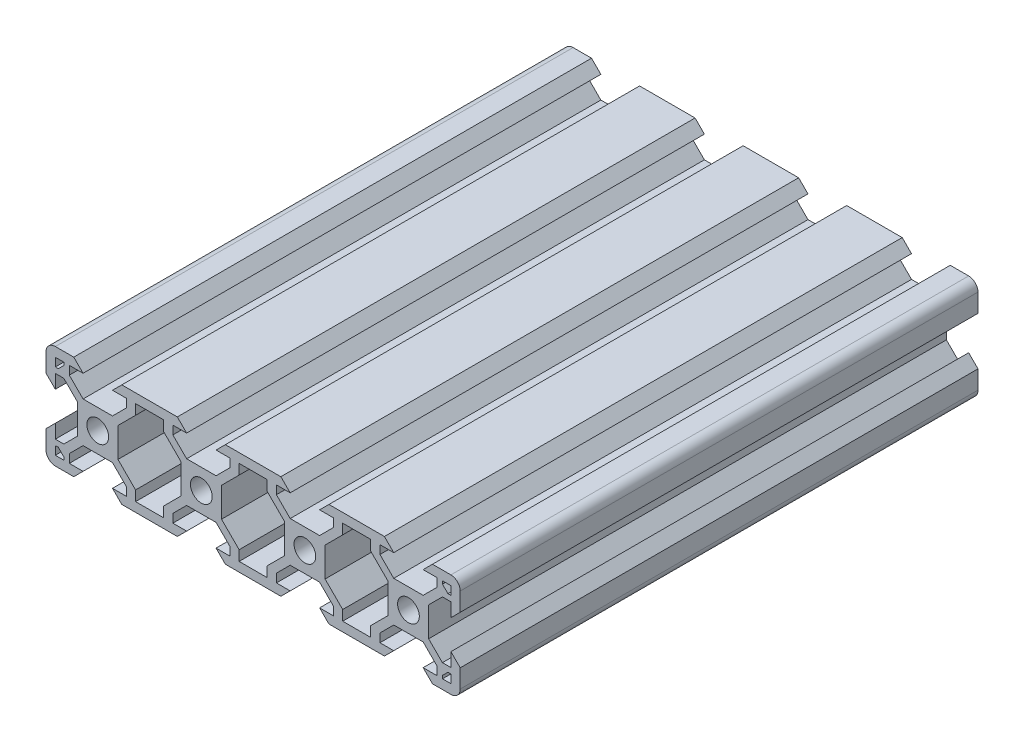
from build123d import *

# Parameters (mm, degrees)
ESQUISSE1_R        = 2.1
BOSS_EXTRU_1_DEPTH = 50


with BuildPart() as part:
    # Esquisse1 → Boss.-Extru.1 (new, symmetric)
    with BuildSketch(Plane.XY):
        with BuildLine():
            Line((-38.199999929, 10), (-34.639999675, 10))
            Line((-34.639999675, 10), (-32.839999603, 8.2))
            Line((-32.839999603, 8.2), (-35.499339671, 8.2))
            Line((-35.499339671, 8.2), (-35.499339671, 6.56))
            Line((-35.499339671, 6.56), (-32.839999603, 3.900660038))
            Line((-32.839999603, 3.900660038), (-27.159999603, 3.900660038))
            Line((-27.159999603, 3.900660038), (-24.500659536, 6.56))
            Line((-24.500659536, 6.56), (-24.500659536, 8.2))
            Line((-24.500659536, 8.2), (-27.159999603, 8.2))
            Line((-27.159999603, 8.2), (-25.359999532, 10))
            Line((-25.359999532, 10), (-14.640000468, 10))
            Line((-14.640000468, 10), (-12.840000397, 8.2))
            Line((-12.840000397, 8.2), (-15.499340464, 8.2))
            Line((-15.499340464, 8.2), (-15.499340464, 6.56))
            Line((-15.499340464, 6.56), (-12.840000397, 3.900660038))
            Line((-12.840000397, 3.900660038), (-7.159998809, 3.900660038))
            Line((-7.159998809, 3.900660038), (-4.500658742, 6.56))
            Line((-4.500658742, 6.56), (-4.500658742, 8.2))
            Line((-4.500658742, 8.2), (-7.159998809, 8.2))
            Line((-7.159998809, 8.2), (-5.359998738, 10))
            Line((-5.359998738, 10), (5.359998738, 10))
            Line((5.359998738, 10), (7.159998809, 8.2))
            Line((7.159998809, 8.2), (4.500658742, 8.2))
            Line((4.500658742, 8.2), (4.500658742, 6.56))
            Line((4.500658742, 6.56), (7.159998809, 3.900660038))
            Line((7.159998809, 3.900660038), (12.840000397, 3.900660038))
            Line((12.840000397, 3.900660038), (15.499340464, 6.56))
            Line((15.499340464, 6.56), (15.499340464, 8.2))
            Line((15.499340464, 8.2), (12.840000397, 8.2))
            Line((12.840000397, 8.2), (14.640000468, 10))
            Line((14.640000468, 10), (25.359999532, 10))
            Line((25.359999532, 10), (27.159999603, 8.2))
            Line((27.159999603, 8.2), (24.500659536, 8.2))
            Line((24.500659536, 8.2), (24.500659536, 6.56))
            Line((24.500659536, 6.56), (27.159999603, 3.900660038))
            Line((27.159999603, 3.900660038), (32.839999603, 3.900660038))
            Line((32.839999603, 3.900660038), (35.499339671, 6.56))
            Line((35.499339671, 6.56), (35.499339671, 8.2))
            Line((35.499339671, 8.2), (32.839999603, 8.2))
            Line((32.839999603, 8.2), (34.639999675, 10))
            Line((34.639999675, 10), (38.199999929, 10))
            ThreePointArc((38.199999929, 10), (39.47279216, 9.472792181), (39.999999929, 8.199999929))
            Line((39.999999929, 8.199999929), (39.999999787, 4.639999675))
            Line((39.999999787, 4.639999675), (38.199999716, 2.839999675))
            Line((38.199999716, 2.839999675), (38.199999821, 5.499339742))
            Line((38.199999821, 5.499339742), (36.559999821, 5.499339807))
            Line((36.559999821, 5.499339807), (33.900659754, 2.839999845))
            Line((33.900659754, 2.839999845), (33.900659641, 0))
            Line((33.900659641, 0), (33.900659754, -2.839999845))
            Line((33.900659754, -2.839999845), (36.559999821, -5.499339807))
            Line((36.559999821, -5.499339807), (38.199999821, -5.499339742))
            Line((38.199999821, -5.499339742), (38.199999716, -2.839999675))
            Line((38.199999716, -2.839999675), (39.999999787, -4.639999675))
            Line((39.999999787, -4.639999675), (39.999999929, -8.199999929))
            ThreePointArc((39.999999929, -8.199999929), (39.47279216, -9.472792181), (38.199999929, -10))
            Line((38.199999929, -10), (34.639999675, -10))
            Line((34.639999675, -10), (32.839999603, -8.2))
            Line((32.839999603, -8.2), (35.499339671, -8.2))
            Line((35.499339671, -8.2), (35.499339671, -6.56))
            Line((35.499339671, -6.56), (32.839999603, -3.900660038))
            Line((32.839999603, -3.900660038), (27.159999603, -3.900660038))
            Line((27.159999603, -3.900660038), (24.500659536, -6.56))
            Line((24.500659536, -6.56), (24.500659536, -8.2))
            Line((24.500659536, -8.2), (27.159999603, -8.2))
            Line((27.159999603, -8.2), (25.359999532, -10))
            Line((25.359999532, -10), (14.640000468, -10))
            Line((14.640000468, -10), (12.840000397, -8.2))
            Line((12.840000397, -8.2), (15.499340464, -8.2))
            Line((15.499340464, -8.2), (15.499340464, -6.56))
            Line((15.499340464, -6.56), (12.840000397, -3.900660038))
            Line((12.840000397, -3.900660038), (7.159998809, -3.900660038))
            Line((7.159998809, -3.900660038), (4.500658742, -6.56))
            Line((4.500658742, -6.56), (4.500658742, -8.2))
            Line((4.500658742, -8.2), (7.159998809, -8.2))
            Line((7.159998809, -8.2), (5.359998738, -10))
            Line((5.359998738, -10), (-5.359998738, -10))
            Line((-5.359998738, -10), (-7.159998809, -8.2))
            Line((-7.159998809, -8.2), (-4.500658742, -8.2))
            Line((-4.500658742, -8.2), (-4.500658742, -6.56))
            Line((-4.500658742, -6.56), (-7.159998809, -3.900660038))
            Line((-7.159998809, -3.900660038), (-12.840000397, -3.900660038))
            Line((-12.840000397, -3.900660038), (-15.499340464, -6.56))
            Line((-15.499340464, -6.56), (-15.499340464, -8.2))
            Line((-15.499340464, -8.2), (-12.840000397, -8.2))
            Line((-12.840000397, -8.2), (-14.640000468, -10))
            Line((-14.640000468, -10), (-25.359999532, -10))
            Line((-25.359999532, -10), (-27.159999603, -8.2))
            Line((-27.159999603, -8.2), (-24.500659536, -8.2))
            Line((-24.500659536, -8.2), (-24.500659536, -6.56))
            Line((-24.500659536, -6.56), (-27.159999603, -3.900660038))
            Line((-27.159999603, -3.900660038), (-32.839999603, -3.900660038))
            Line((-32.839999603, -3.900660038), (-35.499339671, -6.56))
            Line((-35.499339671, -6.56), (-35.499339671, -8.2))
            Line((-35.499339671, -8.2), (-32.839999603, -8.2))
            Line((-32.839999603, -8.2), (-34.639999675, -10))
            Line((-34.639999675, -10), (-38.199999929, -10))
            ThreePointArc((-38.199999929, -10), (-39.47279216, -9.472792181), (-39.999999929, -8.199999929))
            Line((-39.999999929, -8.199999929), (-39.999999787, -4.639999675))
            Line((-39.999999787, -4.639999675), (-38.199999716, -2.839999675))
            Line((-38.199999716, -2.839999675), (-38.199999821, -5.499339742))
            Line((-38.199999821, -5.499339742), (-36.559999821, -5.499339807))
            Line((-36.559999821, -5.499339807), (-33.900659754, -2.839999845))
            Line((-33.900659754, -2.839999845), (-33.900659641, 0))
            Line((-33.900659641, 0), (-33.900659754, 2.839999845))
            Line((-33.900659754, 2.839999845), (-36.559999821, 5.499339807))
            Line((-36.559999821, 5.499339807), (-38.199999821, 5.499339742))
            Line((-38.199999821, 5.499339742), (-38.199999716, 2.839999675))
            Line((-38.199999716, 2.839999675), (-39.999999787, 4.639999675))
            Line((-39.999999787, 4.639999675), (-39.999999929, 8.199999929))
            ThreePointArc((-39.999999929, 8.199999929), (-39.47279216, 9.472792181), (-38.199999929, 10))
        make_face()
        with Locations((-29.999999603, 0)):
            Circle(ESQUISSE1_R, mode=Mode.SUBTRACT)
        with Locations((-9.999999603, 0)):
            Circle(ESQUISSE1_R, mode=Mode.SUBTRACT)
        with Locations(Location((29.999999603, 0, 0), (0, 0, 180))):
            Circle(ESQUISSE1_R, mode=Mode.SUBTRACT)
        with Locations(Location((9.999999603, 0, 0), (0, 0, 180))):
            Circle(ESQUISSE1_R, mode=Mode.SUBTRACT)
        Polygon((-38.199999929, 8.2), (-38.199999864, 6.569339742), (-37.629999799, 6.569339742), (-36.569339648, 7.629999935), (-36.569339648, 8.2), align=None, mode=Mode.SUBTRACT)
        Polygon((-17.3, 6.239339079), (-17.3, 8.2), (-22.7, 8.2), (-22.7, 6.239339079), (-26.099339368, 2.839999845), (-26.099339368, -2.839999845), (-22.7, -6.239339079), (-22.7, -8.2), (-17.3, -8.2), (-17.3, -6.239339079), (-13.900660632, -2.839999845), (-13.900660632, 2.839999845), align=None, mode=Mode.SUBTRACT)
        Polygon((-6.099339678, -2.840000949), (-6.099339678, 2.840000949), (-2.700001413, 6.239339079), (-2.700001413, 8.2), (2.700001413, 8.2), (2.700001413, 6.239339079), (6.099339678, 2.840000949), (6.099339678, -2.840000949), (2.700001413, -6.239339079), (2.700001413, -8.2), (-2.700001413, -8.2), (-2.700001413, -6.239339079), align=None, mode=Mode.SUBTRACT)
        Polygon((-36.569339648, -7.629999935), (-36.569339648, -8.2), (-38.199999929, -8.2), (-38.199999864, -6.569339742), (-37.629999799, -6.569339742), align=None, mode=Mode.SUBTRACT)
        Polygon((36.569339648, 8.2), (38.199999929, 8.2), (38.199999864, 6.569339742), (37.629999799, 6.569339742), (36.569339648, 7.629999935), align=None, mode=Mode.SUBTRACT)
        Polygon((36.569339648, -8.2), (38.199999929, -8.2), (38.199999864, -6.569339742), (37.629999799, -6.569339742), (36.569339648, -7.629999935), align=None, mode=Mode.SUBTRACT)
        Polygon((13.900660632, -2.839999845), (17.3, -6.239339079), (17.3, -8.2), (22.7, -8.2), (22.7, -6.239339079), (26.099339368, -2.839999845), (26.099339368, 2.839999845), (22.7, 6.239339079), (22.7, 8.2), (17.3, 8.2), (17.3, 6.239339079), (13.900660632, 2.839999845), align=None, mode=Mode.SUBTRACT)
    extrude(amount=BOSS_EXTRU_1_DEPTH, both=True)


solid = part.part
